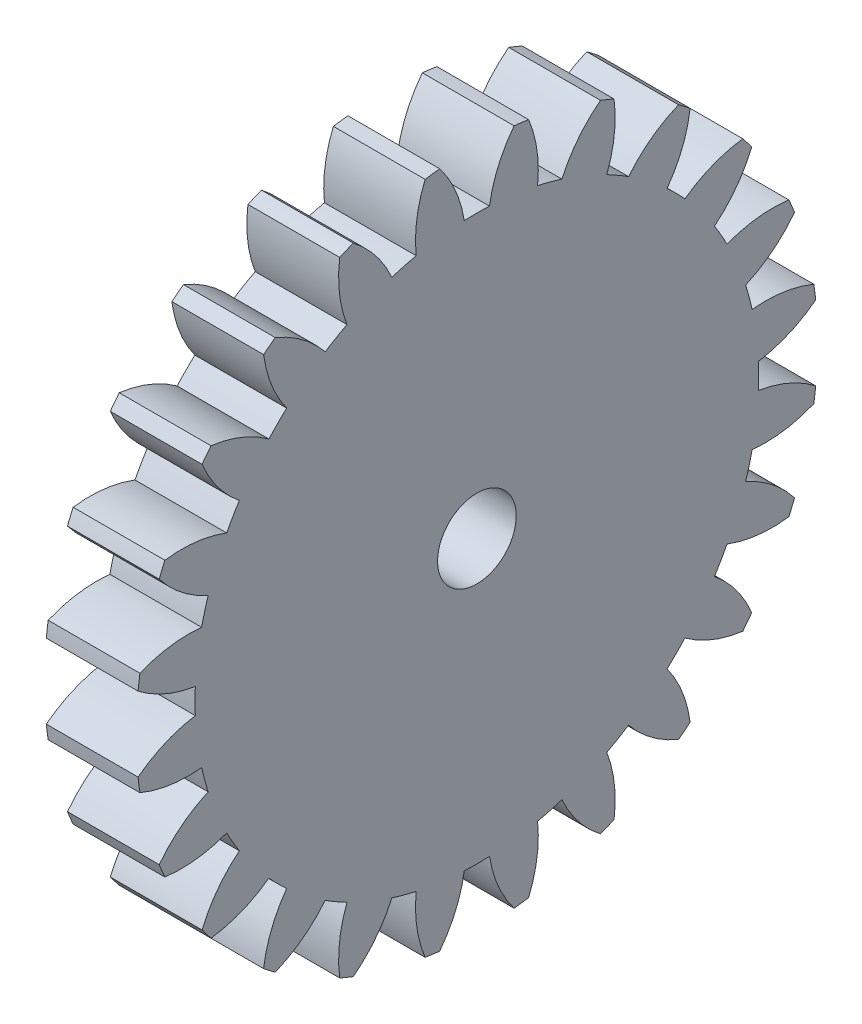
from build123d import *

# Parameters (mm, degrees)
BASPROSKE_W     = 22.225
BASPROSKE_H     = 82.55
TOOTHCUT_DEPTH  = 119.840042179
TEETHCUTS_COUNT = 24
TEETHCUTS_ANGLE = 345
BORSKE_R        = 9.525
BORE_DEPTH      = 25.4000508


with BuildPart() as part:
    # BasProSke → Base-Revolve (revolve)
    with BuildSketch(Plane(origin=(0, 0, 0), x_dir=(1, 0, 0), z_dir=(0, 1, 0)), mode=Mode.PRIVATE) as base_revolve_sk:
        with Locations((11.1125, 41.275)):
            Rectangle(BASPROSKE_W, BASPROSKE_H)
    revolve(base_revolve_sk.sketch.rotate(Axis((-10, 0, 0), (1, 0, 0)), 180), axis=Axis((-10, 0, 0), (1, 0, 0)))

    # TooCutSke → ToothCut (cut, through all)
    with BuildSketch(Plane(origin=(0, 0, 0), x_dir=(0, 0, -1), z_dir=(1, 0, 0))):
        with BuildLine():
            ThreePointArc((3.050766134, 68.193022716), (0, 68.26123), (-3.050766134, 68.193022716))
            ThreePointArc((-3.050766134, 68.193022716), (-5.164725154, 75.513208068), (-9.02816666, 82.080380676))
            ThreePointArc((-9.02816666, 82.080380676), (0, 82.5754), (9.02816666, 82.080380676))
            ThreePointArc((9.02816666, 82.080380676), (5.164725154, 75.513208068), (3.050766134, 68.193022716))
        make_face()
    toothcut = extrude(amount=TOOTHCUT_DEPTH, mode=Mode.SUBTRACT)

    # TeethCuts: ToothCut ×24 about axis
    teethcuts_axis = Axis((-10, 0, 0), (1, 0, 0))
    for i in range(1, TEETHCUTS_COUNT):
        add(toothcut.rotate(teethcuts_axis, i * TEETHCUTS_ANGLE / (TEETHCUTS_COUNT - 1)), mode=Mode.SUBTRACT)

    # BorSke → Bore (cut, symmetric)
    with BuildSketch(Plane(origin=(0, 0, 0), x_dir=(0, 0, -1), z_dir=(1, 0, 0))):
        with Locations(Location((0, 0, 0), (0, 0, 180))):
            Circle(BORSKE_R)
    extrude(amount=BORE_DEPTH, both=True, mode=Mode.SUBTRACT)


solid = part.part
